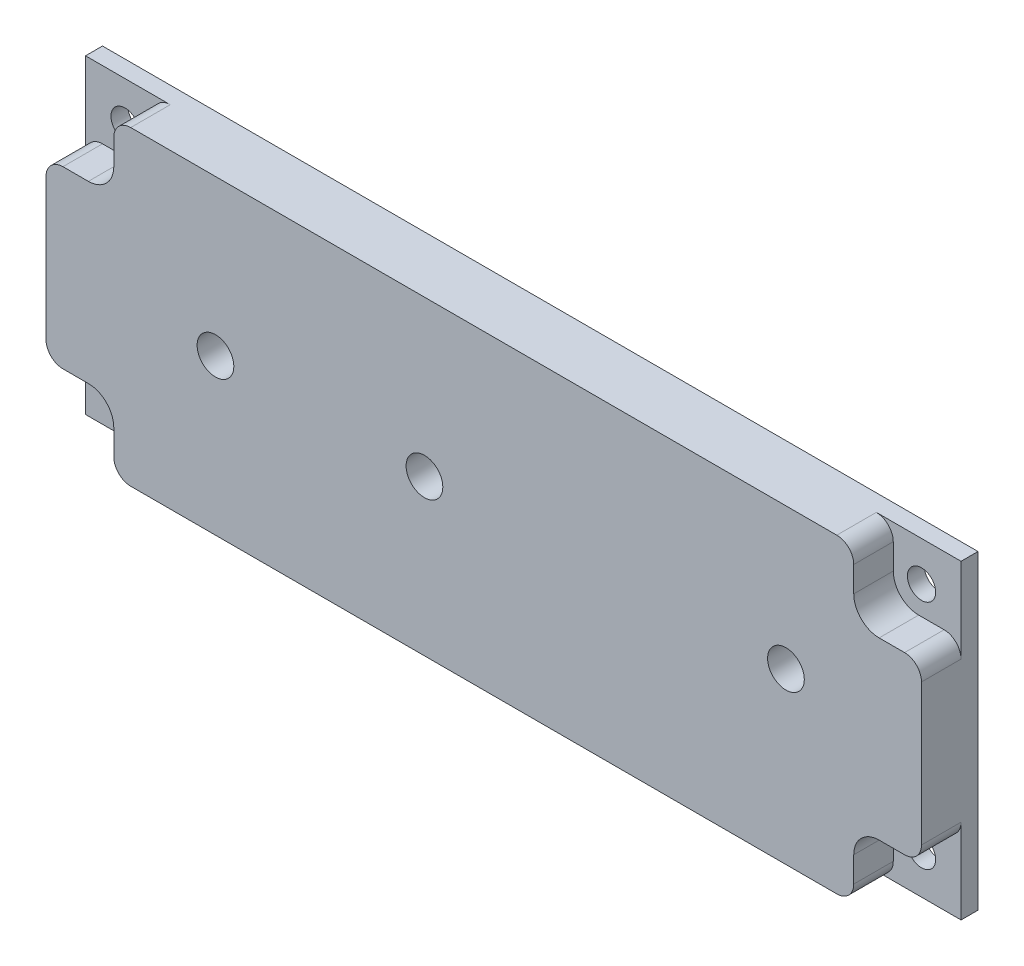
from build123d import *

# Parameters (mm, degrees)
SKETCH1_W           = 155
SKETCH1_H           = 55
SKETCH1_R           = 3.25
BOSS_EXTRUDE1_DEPTH = 10
CUT_EXTRUDE1_DEPTH  = 7
SKETCH3_R           = 2.5
CUT_EXTRUDE2_DEPTH  = 10
FILLET1_R           = 3


with BuildPart() as part:
    # Sketch1 → Boss-Extrude1 (new body)
    with BuildSketch(Plane.XY):
        with Locations((2.15707133, 4.04038984)):
            Rectangle(SKETCH1_W, SKETCH1_H)
        with Locations((-45.34292867, 4.04038984)):
            Circle(SKETCH1_R, mode=Mode.SUBTRACT)
        with Locations((-8.34292867, 4.04038984)):
            Circle(SKETCH1_R, mode=Mode.SUBTRACT)
        with Locations((55.65707133, 6.54038984)):
            Circle(SKETCH1_R, mode=Mode.SUBTRACT)
    extrude(amount=BOSS_EXTRUDE1_DEPTH)

    # Sketch2 → Cut-Extrude1 (cut)
    with BuildSketch(Plane.XY.offset(10)):
        with BuildLine():
            Line((-75.34292867, 31.54038984), (-63.34292867, 31.54038984))
            Line((-63.34292867, 31.54038984), (-63.34292867, 24.04038984))
            ThreePointArc((-63.34292867, 24.04038984), (-64.660948155, 20.858409325), (-67.84292867, 19.54038984))
            Line((-67.84292867, 19.54038984), (-75.34292867, 19.54038984))
            Line((-75.34292867, 19.54038984), (-75.34292867, 31.54038984))
        make_face()
        with BuildLine():
            Line((-75.34292867, -23.45961016), (-63.34292867, -23.45961016))
            Line((-63.34292867, -23.45961016), (-63.34292867, -15.95961016))
            ThreePointArc((-63.34292867, -15.95961016), (-64.660948155, -12.777629645), (-67.84292867, -11.45961016))
            Line((-67.84292867, -11.45961016), (-75.34292867, -11.45961016))
            Line((-75.34292867, -11.45961016), (-75.34292867, -23.45961016))
        make_face()
        with BuildLine():
            Line((79.65707133, -23.45961016), (67.65707133, -23.45961016))
            Line((67.65707133, -23.45961016), (67.65707133, -15.95961016))
            ThreePointArc((67.65707133, -15.95961016), (68.975090815, -12.777629645), (72.15707133, -11.45961016))
            Line((72.15707133, -11.45961016), (79.65707133, -11.45961016))
            Line((79.65707133, -11.45961016), (79.65707133, -23.45961016))
        make_face()
        with BuildLine():
            Line((79.65707133, 31.54038984), (67.65707133, 31.54038984))
            Line((67.65707133, 31.54038984), (67.65707133, 24.04038984))
            ThreePointArc((67.65707133, 24.04038984), (68.975090815, 20.858409325), (72.15707133, 19.54038984))
            Line((72.15707133, 19.54038984), (79.65707133, 19.54038984))
            Line((79.65707133, 19.54038984), (79.65707133, 31.54038984))
        make_face()
    extrude(amount=-CUT_EXTRUDE1_DEPTH, mode=Mode.SUBTRACT)

    # Sketch3 → Cut-Extrude2 (cut)
    with BuildSketch(Plane.XY.offset(3)):
        with Locations((-68.34292867, -16.45961016)):
            Circle(SKETCH3_R)
        with Locations((72.65707133, -16.45961016)):
            Circle(SKETCH3_R)
        with Locations((72.65707133, 24.54038984)):
            Circle(SKETCH3_R)
        with Locations((-68.34292867, 24.54038984)):
            Circle(SKETCH3_R)
    extrude(amount=-CUT_EXTRUDE2_DEPTH, mode=Mode.SUBTRACT)

    # Fillet1
    fillet1_edges = [part.edges().sort_by_distance(p)[0] for p in [
        (79.65707133, 19.54038984, 6.5),
        (67.65707133, 31.54038984, 6.5),
        (79.65707133, -11.45961016, 6.5),
        (67.65707133, -23.45961016, 6.5),
        (-75.34292867, -11.45961016, 6.5),
        (-63.34292867, -23.45961016, 6.5),
        (-75.34292867, 19.54038984, 6.5),
        (-63.34292867, 31.54038984, 6.5),
    ]]
    fillet(fillet1_edges, radius=FILLET1_R)


solid = part.part
